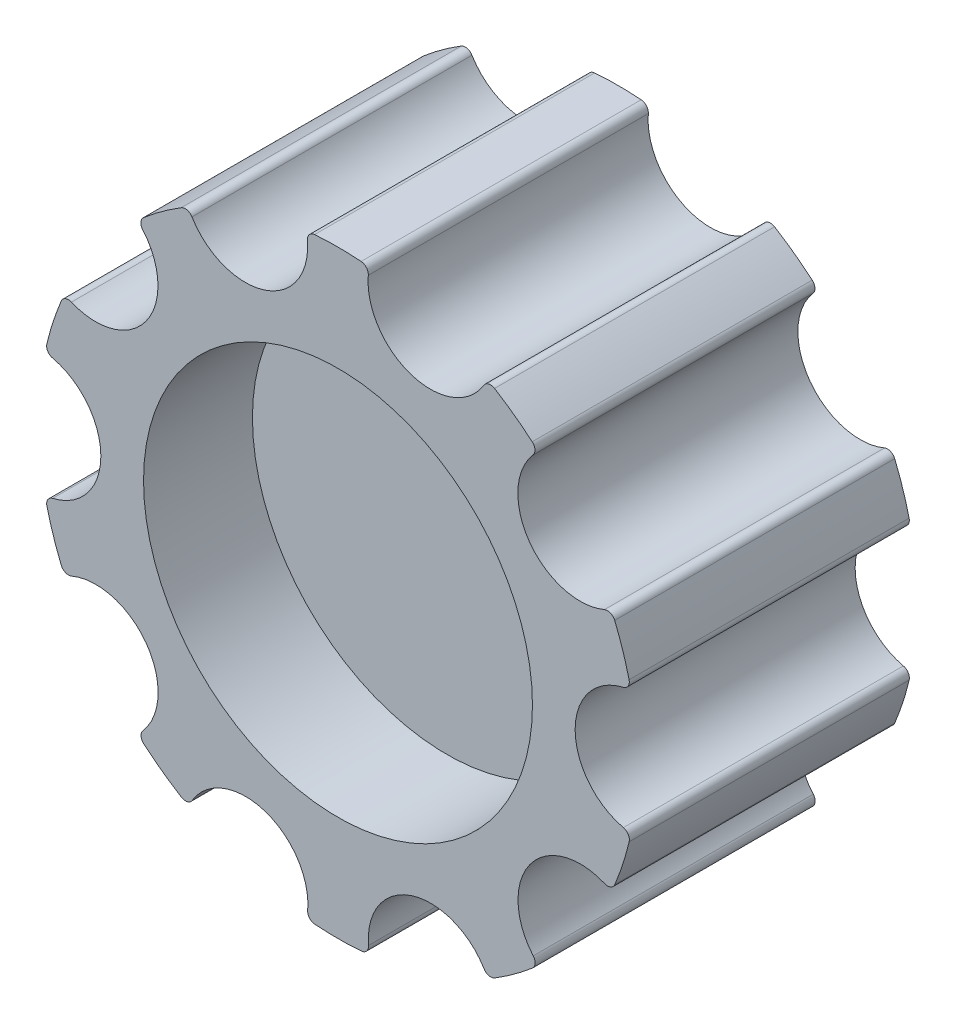
from build123d import *

# Parameters (mm, degrees)
SPROKET_DEPTH       = 9
SKETCH3_R           = 12.5
CUT_EXTRUDE1_DEPTH  = 7
SKETCH4_R           = 4.5
BOSS_EXTRUDE1_DEPTH = 7


with BuildPart() as part:
    # Sprocket → Sproket (new body)
    with BuildSketch(Plane(origin=(-521.333895642, -864.335014518, -1401.843992528), x_dir=(1, 0, 0), z_dir=(0, 0, 1))):
        with BuildLine():
            ThreePointArc((502.621153074, 859.818847383), (503.02864119, 858.378492088), (503.546815178, 856.974153932))
            ThreePointArc((503.546815178, 856.974153932), (503.819037022, 856.702761655), (504.203425444, 856.704771932))
            ThreePointArc((504.203425444, 856.704771932), (509.005673001, 855.369858884), (508.795597259, 850.389955006))
            ThreePointArc((508.795597259, 850.389955006), (508.675219652, 850.024896474), (508.849505331, 849.682284445))
            ThreePointArc((508.849505331, 849.682284445), (510.025789743, 848.756528039), (511.270450563, 847.924969632))
            ThreePointArc((511.270450563, 847.924969632), (511.650203039, 847.865416653), (511.959998194, 848.092980848))
            ThreePointArc((511.959998194, 848.092980848), (516.629740281, 849.835703798), (519.386899492, 845.683397507))
            ThreePointArc((519.386899492, 845.683397507), (519.504087984, 845.317302769), (519.846470359, 845.142566367))
            ThreePointArc((519.846470359, 845.142566367), (521.342250401, 845.085016331), (522.837979924, 845.143864722))
            ThreePointArc((522.837979924, 845.143864722), (523.180210493, 845.318898255), (523.297081161, 845.685094579))
            ThreePointArc((523.297081161, 845.685094579), (526.05063502, 849.839792593), (530.721888079, 848.101123761))
            ThreePointArc((530.721888079, 848.101123761), (531.031880649, 847.873828563), (531.411581288, 847.933711155))
            ThreePointArc((531.411581288, 847.933711155), (532.655519825, 848.766349647), (533.831000211, 849.693126751))
            ThreePointArc((533.831000211, 849.693126751), (534.004988429, 850.035889936), (533.884293987, 850.400843839))
            ThreePointArc((533.884293987, 850.400843839), (533.669895633, 855.380563489), (538.470982641, 856.719644514))
            ThreePointArc((538.470982641, 856.719644514), (538.855372663, 856.717967897), (539.127358829, 856.989596368))
            ThreePointArc((539.127358829, 856.989596368), (539.644313618, 858.394383784), (540.050551314, 859.835092247))
            ThreePointArc((540.050551314, 859.835092247), (539.989839594, 860.214661197), (539.677681217, 860.438972694))
            ThreePointArc((539.677681217, 860.438972694), (536.577223534, 864.341630328), (539.674292437, 868.246977772))
            ThreePointArc((539.674292437, 868.246977772), (539.986255988, 868.471560146), (540.046638209, 868.851181652))
            ThreePointArc((540.046638209, 868.851181652), (539.639150093, 870.291536947), (539.120976106, 871.695875104))
            ThreePointArc((539.120976106, 871.695875104), (538.848754261, 871.967267381), (538.464365839, 871.965257104))
            ThreePointArc((538.464365839, 871.965257104), (533.662118282, 873.300170152), (533.872194024, 878.280074029))
            ThreePointArc((533.872194024, 878.280074029), (533.992571631, 878.645132562), (533.818285952, 878.98774459))
            ThreePointArc((533.818285952, 878.98774459), (532.642001541, 879.913500997), (531.39734072, 880.745059403))
            ThreePointArc((531.39734072, 880.745059403), (531.017588244, 880.804612382), (530.70779309, 880.577048188))
            ThreePointArc((530.70779309, 880.577048188), (526.038051002, 878.834325238), (523.280891791, 882.986631528))
            ThreePointArc((523.280891791, 882.986631528), (523.163703299, 883.352726267), (522.821320924, 883.527462669))
            ThreePointArc((522.821320924, 883.527462669), (521.325540883, 883.585012705), (519.829811359, 883.526164313))
            ThreePointArc((519.829811359, 883.526164313), (519.48758079, 883.35113078), (519.370710122, 882.984934457))
            ThreePointArc((519.370710122, 882.984934457), (516.617156263, 878.830236442), (511.945903204, 880.568905275))
            ThreePointArc((511.945903204, 880.568905275), (511.635910634, 880.796200472), (511.256209995, 880.736317881))
            ThreePointArc((511.256209995, 880.736317881), (510.012271459, 879.903679389), (508.836791072, 878.976902284))
            ThreePointArc((508.836791072, 878.976902284), (508.662802855, 878.6341391), (508.783497297, 878.269185196))
            ThreePointArc((508.783497297, 878.269185196), (508.99789565, 873.289465546), (504.196808642, 871.950384521))
            ThreePointArc((504.196808642, 871.950384521), (503.81241862, 871.952061138), (503.540432454, 871.680432668))
            ThreePointArc((503.540432454, 871.680432668), (503.023477665, 870.275645251), (502.617239969, 868.834936788))
            ThreePointArc((502.617239969, 868.834936788), (502.677951689, 868.455367839), (502.990110067, 868.231056341))
            ThreePointArc((502.990110067, 868.231056341), (506.090567749, 864.328398708), (502.993498846, 860.423051264))
            ThreePointArc((502.993498846, 860.423051264), (502.681535295, 860.198468889), (502.621153074, 859.818847383))
        make_face()
    sproket = extrude(amount=SPROKET_DEPTH)

    # Sketch3 → Cut-Extrude1 (cut)
    with BuildSketch(Plane.XY.offset(-1392.843992528)):
        Circle(SKETCH3_R)
    cut_extrude1 = extrude(amount=-CUT_EXTRUDE1_DEPTH, mode=Mode.SUBTRACT)

    # Mirror1: Sproket, Cut-Extrude1 across plane
    add(sproket.mirror(Plane(origin=(9.113348653, 2.199432046, -1401.843992528), x_dir=(1, 0, 0), z_dir=(0, 0, 1))))
    add(cut_extrude1.mirror(Plane(origin=(9.113348653, 2.199432046, -1401.843992528), x_dir=(1, 0, 0), z_dir=(0, 0, 1))), mode=Mode.SUBTRACT)

    # Sketch4 → Boss-Extrude1 (add)
    with BuildSketch(Plane(origin=(0, 0, -1403.843992528), x_dir=(-1, 0, 0), z_dir=(0, 0, -1))):
        Circle(SKETCH4_R)
        with BuildLine():
            Line((-1.303840481, 1.45), (1.303840481, 1.45))
            ThreePointArc((1.303840481, 1.45), (0, -1.95), (-1.303840481, 1.45))
        make_face(mode=Mode.SUBTRACT)
    extrude(amount=BOSS_EXTRUDE1_DEPTH)


solid = part.part
